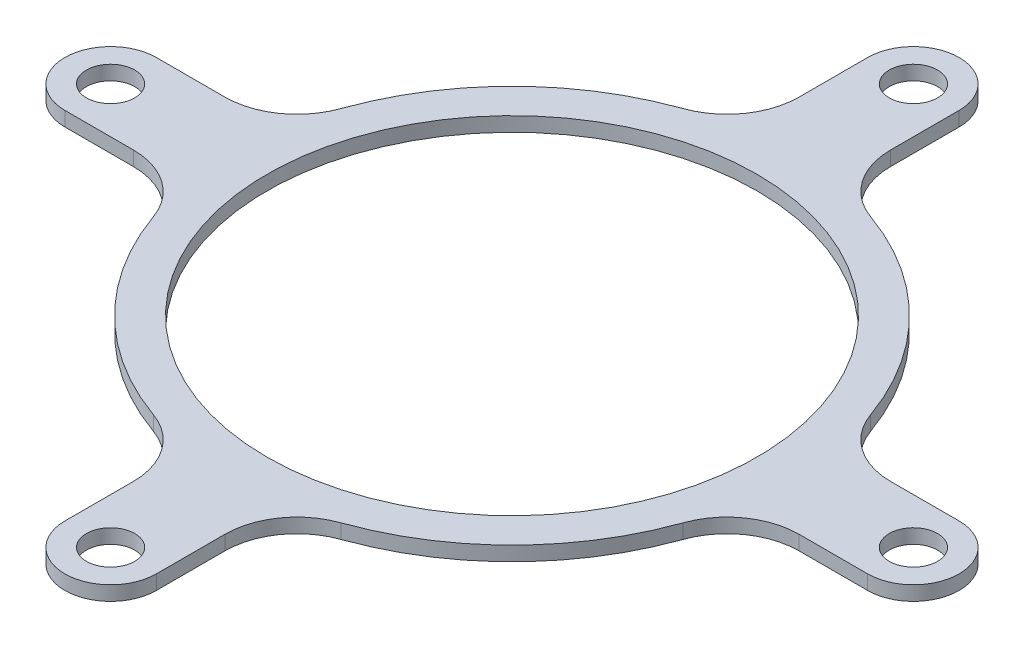
from build123d import *

# Parameters (mm, degrees)
SKETCH1_R           = 39
SKETCH1_R_2         = 34
BOSS_EXTRUDE1_DEPTH = 1
SKETCH2_R           = 3.35
BOSS_EXTRUDE2_DEPTH = 2
CIRPATTERN1_COUNT   = 4


with BuildPart() as part:
    # Sketch1 → Boss-Extrude1 (new, symmetric)
    with BuildSketch(Plane(origin=(0, 0, 0), x_dir=(1, 0, 0), z_dir=(0, 1, 0))):
        with Locations(Location((0, 0, 0), (0, 0, 270))):
            Circle(SKETCH1_R)
        with Locations(Location((0, 0, 0), (0, 0, 270))):
            Circle(SKETCH1_R_2, mode=Mode.SUBTRACT)
    extrude(amount=BOSS_EXTRUDE1_DEPTH, both=True)

    # Sketch2 → Boss-Extrude2 (add)
    with BuildSketch(Plane(origin=(0, 1, 0), x_dir=(1, 0, 0), z_dir=(0, 1, 0))):
        with BuildLine():
            Line((-6.35, 46.191747098), (-6.35, 55.7))
            ThreePointArc((-6.35, 55.7), (0, 62.05), (6.35, 55.7))
            Line((6.35, 55.7), (6.35, 46.191747098))
            ThreePointArc((6.35, 46.191747098), (8.183992807, 40.419717427), (13.013265306, 36.764859935))
            ThreePointArc((13.013265306, 36.764859935), (0, 39), (-13.013265306, 36.764859935))
            ThreePointArc((-13.013265306, 36.764859935), (-8.183992807, 40.419717427), (-6.35, 46.191747098))
        make_face()
        with Locations(Location((0, 55.7, 0), (0, 0, 270))):
            Circle(SKETCH2_R, mode=Mode.SUBTRACT)
    boss_extrude2 = extrude(amount=-BOSS_EXTRUDE2_DEPTH)

    # CirPattern1: Boss-Extrude2 ×4 about axis
    cirpattern1_axis = Axis((0, 0, 0), (0, 1, 0))
    for i in range(1, CIRPATTERN1_COUNT):
        add(boss_extrude2.rotate(cirpattern1_axis, i * 360 / CIRPATTERN1_COUNT))


solid = part.part
